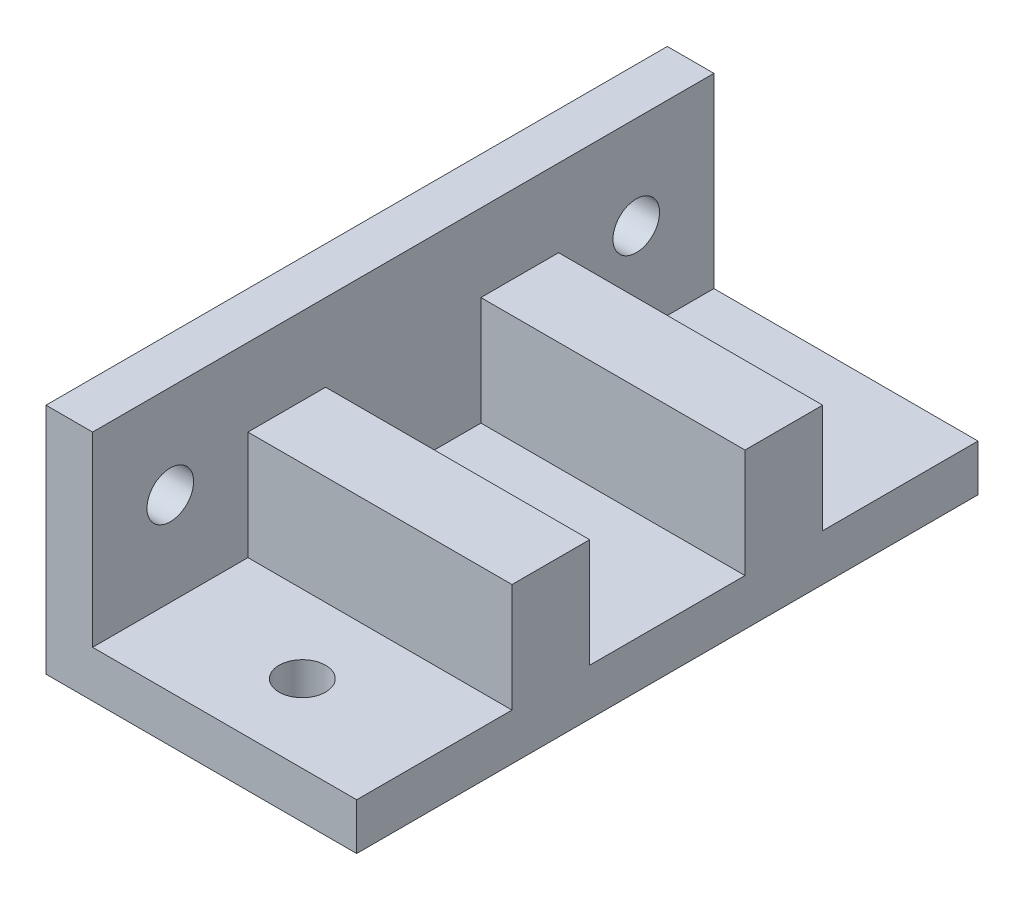
from build123d import *

# Parameters (mm, degrees)
EXTRUDE_1_DEPTH     = 40
SKETCH_3_R          = 1.5
CUT_EXTRUDE_1_DEPTH = 46.97825573
SKETCH_4_R          = 1.5
CUT_EXTRUDE_2_DEPTH = 47.303347611
SKETCH_5_W          = 17
SKETCH_5_H          = 5
EXTRUDE_2_DEPTH     = 7


with BuildPart() as part:
    # 草图1 → 凸台-拉伸1 (new body)
    with BuildSketch(Plane.XY):
        Polygon((0, 0), (0, 15), (3, 15), (3, 3), (20, 3), (20, 0), align=None)
    extrude(amount=EXTRUDE_1_DEPTH)

    # 草图3 → 切除-拉伸1 (cut, through all)
    with BuildSketch(Plane(origin=(3, 0, 0), x_dir=(0, 0, -1), z_dir=(1, 0, 0))):
        with Locations(Location((-35, 9, 0), (0, 0, 90))):
            Circle(SKETCH_3_R)
        with Locations(Location((-5, 9, 0), (0, 0, 270))):
            Circle(SKETCH_3_R)
    extrude(amount=-CUT_EXTRUDE_1_DEPTH, mode=Mode.SUBTRACT)

    # 草图4 → 切除-拉伸2 (cut, through all)
    with BuildSketch(Plane(origin=(0, 3, 0), x_dir=(1, 0, 0), z_dir=(0, 1, 0))):
        with Locations(Location((11.5, -20, 0), (0, 0, 270))):
            Circle(SKETCH_4_R)
        with Locations(Location((11.5, -35, 0), (0, 0, 270))):
            Circle(SKETCH_4_R)
        with Locations(Location((11.5, -5, 0), (0, 0, 90))):
            Circle(SKETCH_4_R)
    extrude(amount=-CUT_EXTRUDE_2_DEPTH, mode=Mode.SUBTRACT)

    # 草图5 → 凸台-拉伸2 (add)
    with BuildSketch(Plane(origin=(0, 3, 0), x_dir=(1, 0, 0), z_dir=(0, 1, 0))):
        with Locations((11.5, -27.5)):
            Rectangle(SKETCH_5_W, SKETCH_5_H)
        with Locations((11.5, -12.5)):
            Rectangle(SKETCH_5_W, SKETCH_5_H)
    extrude(amount=EXTRUDE_2_DEPTH)


solid = part.part
